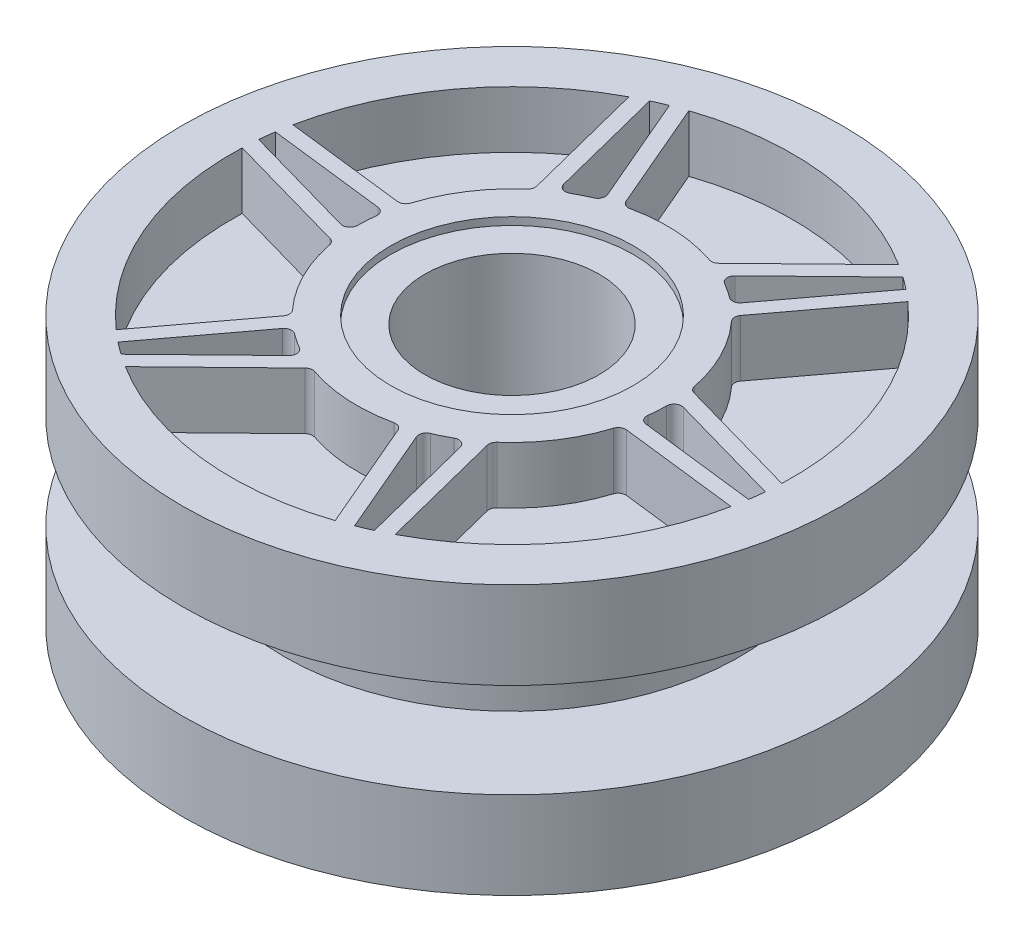
from build123d import *

# Parameters (mm, degrees)
SKETCH1_R           = 8.7
BOSS_EXTRUDE1_DEPTH = 2.3
SKETCH2_R           = 6
BOSS_EXTRUDE2_DEPTH = 1.25
SKETCH3_R           = 7.4
SKETCH3_R_2         = 4.1
SKETCH3_R_3         = 3.2
CUT_EXTRUDE2_DEPTH  = 1.5
BOSS_EXTRUDE3_START = 1.3
SKETCH6_R           = 3.2
BOSS_EXTRUDE3_DEPTH = 1.3
SKETCH7_R           = 2.3
CUT_EXTRUDE3_DEPTH  = 13.751568531
SKETCH9_R           = 0.75
CUT_EXTRUDE4_DEPTH  = 0.2
CIRPATTERN1_COUNT   = 6
BOSS_EXTRUDE4_DEPTH = 1.5
CIRPATTERN2_COUNT   = 6
FILLET2_R           = 0.2


with BuildPart() as part:
    # Sketch1 → Boss-Extrude1 (new body)
    with BuildSketch(Plane(origin=(0, 0, 0), x_dir=(1, 0, 0), z_dir=(0, 1, 0))):
        with Locations(Location((0, 0, 0), (0, 0, 270))):
            Circle(SKETCH1_R)
    extrude(amount=BOSS_EXTRUDE1_DEPTH)

    # Sketch2 → Boss-Extrude2 (add)
    with BuildSketch(Plane(origin=(0, 2.3, 0), x_dir=(1, 0, 0), z_dir=(0, 1, 0))):
        with Locations(Location((0, 0, 0), (0, 0, 270))):
            Circle(SKETCH2_R)
    extrude(amount=BOSS_EXTRUDE2_DEPTH)

    # Sketch3 → Cut-Extrude2 (cut)
    # profile 1 of 2: a face of its own
    with BuildSketch(Plane.XZ):
        with Locations(Location((0, 0, 0), (0, 0, 270))):
            Circle(SKETCH3_R)
        with Locations(Location((0, 0, 0), (0, 0, 270))):
            Circle(SKETCH3_R_2, mode=Mode.SUBTRACT)
    # profile 2 of 2: a face of its own
    with BuildSketch(Plane.XZ):
        with Locations(Location((0, 0, 0), (0, 0, 270))):
            Circle(SKETCH3_R_3)
    extrude(amount=-CUT_EXTRUDE2_DEPTH, mode=Mode.SUBTRACT)

    # Sketch6 → Boss-Extrude3 (add)
    with BuildSketch(Plane.XZ.offset(-1.5).offset(BOSS_EXTRUDE3_START)):
        with Locations(Location((0, 0, 0), (0, 0, 270))):
            Circle(SKETCH6_R)
    extrude(amount=-BOSS_EXTRUDE3_DEPTH)

    # Sketch7 → Cut-Extrude3 (cut, through all)
    with BuildSketch(Plane.XZ.offset(-0.2)):
        with Locations(Location((0, 0, 0), (0, 0, 270))):
            Circle(SKETCH7_R)
    extrude(amount=-CUT_EXTRUDE3_DEPTH, mode=Mode.SUBTRACT)

    # Mirror4: part across plane


with BuildPart() as part_1:
    add(part.part)
    add(part.part.mirror(Plane.ZX.offset(3.55)))

    # Sketch9 → Cut-Extrude4 (cut)
    with BuildSketch(Plane.XZ.offset(-1.5)):
        with Locations(Location((0, -5.557983599, 0), (0, 0, 270))):
            Circle(SKETCH9_R)
    cut_extrude4 = extrude(amount=-CUT_EXTRUDE4_DEPTH, mode=Mode.SUBTRACT)

    # CirPattern1: Cut-Extrude4 ×6 about axis
    cirpattern1_axis = Axis((0, 0, 0), (0, 1, 0))
    for i in range(1, CIRPATTERN1_COUNT):
        add(cut_extrude4.rotate(cirpattern1_axis, i * 360 / CIRPATTERN1_COUNT), mode=Mode.SUBTRACT)

    # Sketch10 → Boss-Extrude4 (add)
    with BuildSketch(Plane(origin=(0, 7.1, 0), x_dir=(1, 0, 0), z_dir=(0, 1, 0))):
        with BuildLine():
            Line((7.321025788, -1.078230685), (4.042247415, -0.68573744))
            ThreePointArc((4.042247415, -0.68573744), (4.003777056, -0.883045462), (3.955681811, -1.078230685))
            Line((3.955681811, -1.078230685), (7.25195199, -1.472817823))
            ThreePointArc((7.25195199, -1.472817823), (7.289159422, -1.275991739), (7.321025788, -1.078230685))
        make_face()
        with BuildLine():
            Line((7.368334518, -0.683846791), (4.092875821, 0.241593702))
            ThreePointArc((4.092875821, 0.241593702), (4.074467049, 0.456856947), (4.044744505, 0.670851615))
            Line((4.044744505, 0.670851615), (7.394863003, -0.275683086))
            ThreePointArc((7.394863003, -0.275683086), (7.384419386, -0.479948264), (7.368334518, -0.683846791))
        make_face()
    boss_extrude4 = extrude(amount=-BOSS_EXTRUDE4_DEPTH)

    # CirPattern2: Boss-Extrude4 ×6 about axis
    cirpattern2_axis = Axis((0, 0, 0), (0, 1, 0))
    for i in range(1, CIRPATTERN2_COUNT):
        add(boss_extrude4.rotate(cirpattern2_axis, i * 360 / CIRPATTERN2_COUNT))

    # Fillet2
    fillet2_edges = [part_1.edges().sort_by_distance(p)[0] for p in [
        (2.603346793, 6.35, 3.167425686),
        (2.255664194, 6.35, 3.423737584),
        (1.427257664, 6.35, 3.84355767),
        (1.044065742, 6.35, 3.96483628),
        (-1.441397712, 6.35, 3.838277301),
        (-1.837211627, 6.35, 3.665331286),
        (-2.614989751, 6.35, 3.157820229),
        (-2.91161607, 6.35, 2.886605595),
        (-4.044744505, 6.35, 0.670851615),
        (-4.092875821, 6.35, 0.241593702),
        (-4.042247415, 6.35, -0.68573744),
        (-3.955681811, 6.35, -1.078230685),
        (-2.603346793, 6.35, -3.167425686),
        (-2.255664194, 6.35, -3.423737584),
        (-1.427257664, 6.35, -3.84355767),
        (-1.044065742, 6.35, -3.96483628),
        (1.441397712, 6.35, -3.838277301),
        (1.837211627, 6.35, -3.665331286),
        (2.614989751, 6.35, -3.157820229),
        (2.91161607, 6.35, -2.886605595),
        (4.044744505, 6.35, -0.670851615),
        (4.092875821, 6.35, -0.241593702),
        (4.042247415, 6.35, 0.68573744),
        (3.955681811, 6.35, 1.078230685),
    ]]
    fillet(fillet2_edges, radius=FILLET2_R)


solid = part_1.part
